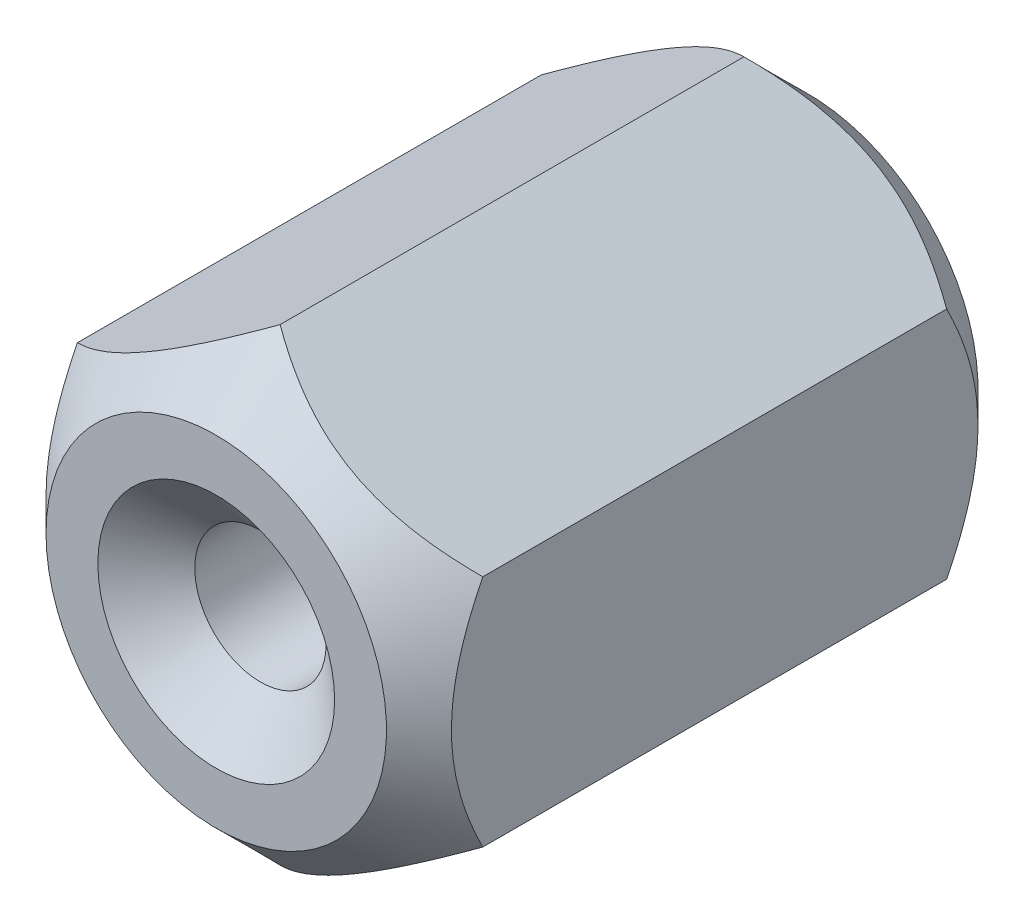
from build123d import *

# Parameters (mm, degrees)
BOSS_EXTRUDE1_DEPTH      = 4.6325
BOSS_EXTRUDE1_DEPTH_BACK = 4.6325


with BuildPart() as part:
    # Sketch1 → Boss-Extrude1 (new, two sides: drawn at the far end of the back side and taken through both)
    with BuildSketch(Plane.XY.offset(-BOSS_EXTRUDE1_DEPTH_BACK)):
        Polygon((3.175, -1.833087105), (3.175, 1.833087105), (0, 3.666174209), (-3.175, 1.833087105), (-3.175, -1.833087105), (0, -3.666174209), align=None)
    extrude(amount=BOSS_EXTRUDE1_DEPTH + BOSS_EXTRUDE1_DEPTH_BACK)

    # Sketch3 → Cut-Revolve2 (revolve, cut)
    with BuildSketch(Plane(origin=(0, 0, 0), x_dir=(0, 0, -1), z_dir=(1, 0, 0))):
        Polygon((-3.6325, 3.666174209), (-4.6325, 2.666174209), (-4.6325, 3.666174209), align=None)
    cut_revolve2 = revolve(axis=Axis((0, 0, -0.635), (0, 0, 1)), mode=Mode.SUBTRACT)

    # Mirror1: Cut-Revolve2 across plane
    add(cut_revolve2.mirror(Plane.XY), mode=Mode.SUBTRACT)

    # Sketch4 → CSK for #1 Flat Head Machine Screw (100)1 (revolve, cut)
    with BuildSketch(Plane(origin=(0, 0, 4.6325), x_dir=(0, -1, 0), z_dir=(1, 0, 0))):
        Polygon((0, 0), (0, 9.265), (1.6637, 9.265), (1.0287, 8.63), (1.0287, 0.692676746), (1.8542, 0), align=None)
    revolve(axis=Axis((0, 0, 10.9825), (0, 0, -1)), mode=Mode.SUBTRACT)


solid = part.part
